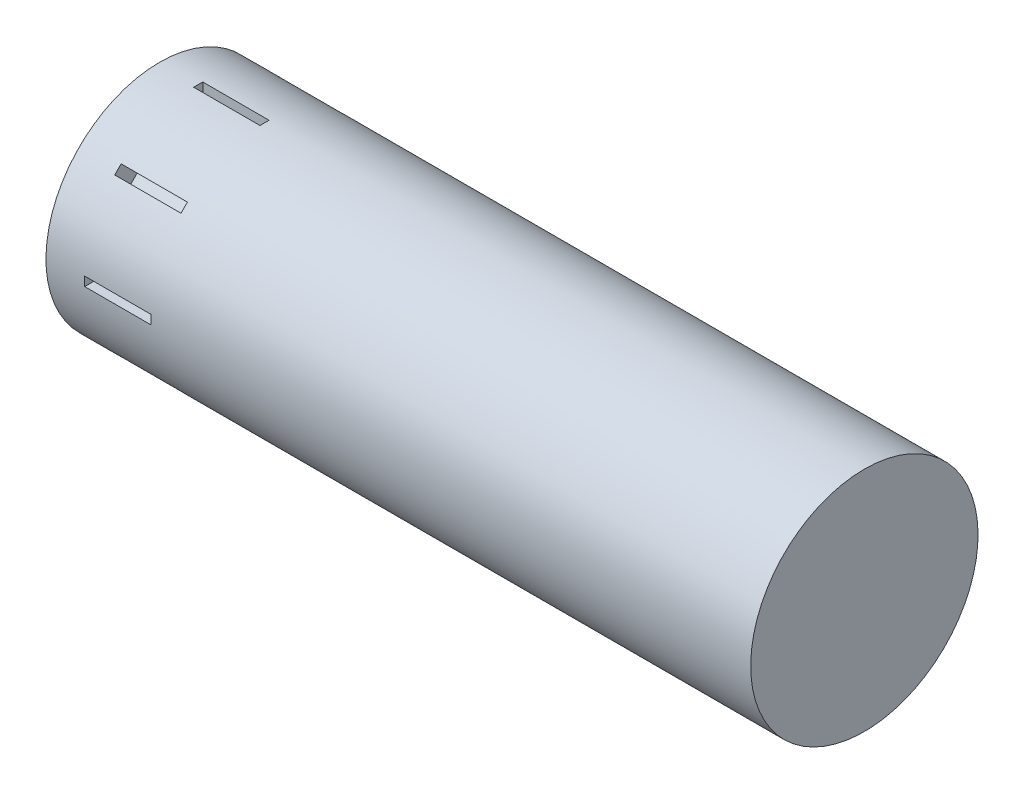
from build123d import *

# Parameters (mm, degrees)
CUT_EXTRUDE1_START = -0.5
CUT_EXTRUDE1_DEPTH = 4
CIRPATTERN1_COUNT  = 8
CUT_EXTRUDE2_DEPTH = 0.2
CIRPATTERN2_COUNT  = 8


with BuildPart() as part:
    # Sketch1 → Revolve1 (revolve)
    with BuildSketch(Plane.XY):
        Polygon((0, 0), (0, 1), (-1, 2), (-7, 2), (-7, 4), (-10, 4), (-10, 2), (-16, 2), (-17.5, 3.5), (-29.5, 3.5), (-29.5, 5), (1.5, 5), (1.5, 0), align=None)
    revolve(axis=Axis((1.5, 0, 0), (-1, 0, 0)))

    # Sketch2 → Cut-Extrude1 (cut)
    with BuildSketch(Plane.ZY.offset(7).offset(CUT_EXTRUDE1_START)):
        with BuildLine():
            Line((-2, -0.1), (-3.9, -0.1))
            ThreePointArc((-3.9, -0.1), (-4, 0), (-3.9, 0.1))
            Line((-3.9, 0.1), (-2, 0.1))
            ThreePointArc((-2, 0.1), (-1.9, 0), (-2, -0.1))
        make_face()
    cut_extrude1 = extrude(amount=CUT_EXTRUDE1_DEPTH, mode=Mode.SUBTRACT)

    # CirPattern1: Cut-Extrude1 ×8 about axis
    cirpattern1_axis = Axis((0, 0, 0), (1, 0, 0))
    for i in range(1, CIRPATTERN1_COUNT):
        add(cut_extrude1.rotate(cirpattern1_axis, i * 360 / CIRPATTERN1_COUNT), mode=Mode.SUBTRACT)

    # Sketch3 → Cut-Extrude2 (cut, symmetric)
    with BuildSketch(Plane.XY):
        Polygon((-14.5, 4.5), (-13, 3), (-10, 3), (-10, 2.5), (-16, 2.5), (-17.5, 4), (-27.8, 4), (-27.8, 5.5), (-24.88457259, 5.5), (-24.88457259, 4.5), align=None)
    cut_extrude2 = extrude(amount=CUT_EXTRUDE2_DEPTH, both=True, mode=Mode.SUBTRACT)

    # CirPattern2: Cut-Extrude2 ×8 about axis
    cirpattern2_axis = Axis((0, 0, 0), (1, 0, 0))
    for i in range(1, CIRPATTERN2_COUNT):
        add(cut_extrude2.rotate(cirpattern2_axis, i * 360 / CIRPATTERN2_COUNT), mode=Mode.SUBTRACT)


solid = part.part
